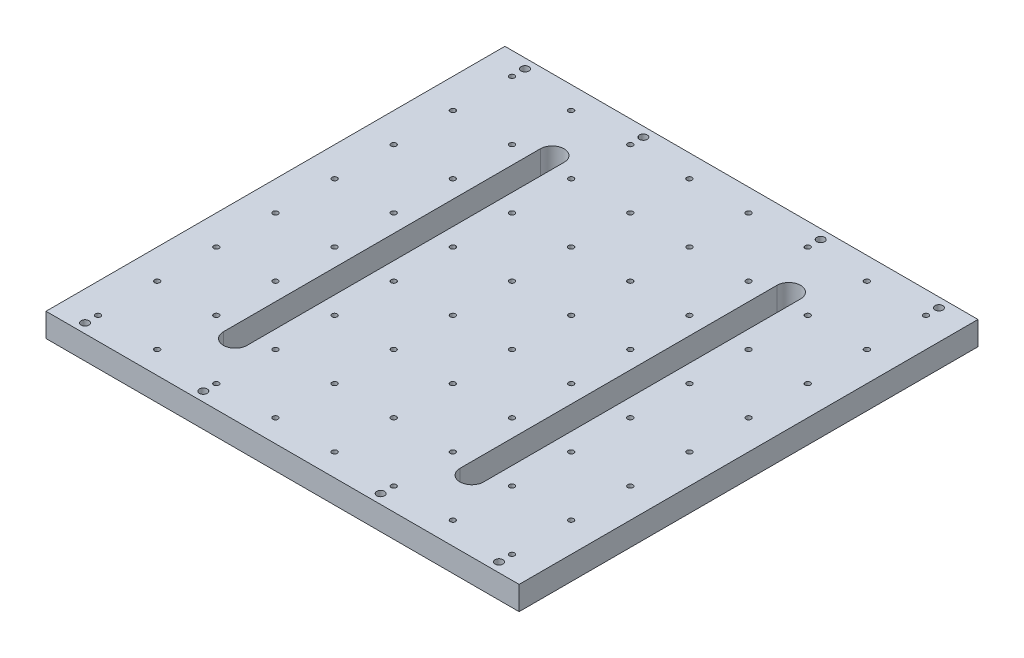
from build123d import *

# Parameters (mm, degrees)
SKETCH1_W           = 200
SKETCH1_H           = 194
BOSS_EXTRUDE2_DEPTH = 10
SKETCH2_R           = 1.1
CUT_EXTRUDE1_DEPTH  = 5
SKETCH5_R           = 1.65
CUT_EXTRUDE3_DEPTH  = 284.051232112
CUT_EXTRUDE4_DEPTH  = 10


with BuildPart() as part:
    # Sketch1 → Boss-Extrude2 (new body)
    with BuildSketch(Plane(origin=(0, 0, 0), x_dir=(1, 0, 0), z_dir=(0, 1, 0))):
        with Locations((103, 100)):
            Rectangle(SKETCH1_W, SKETCH1_H)
    extrude(amount=BOSS_EXTRUDE2_DEPTH)

    # Sketch2 → Cut-Extrude1 (cut)
    with BuildSketch(Plane(origin=(0, 10, 0), x_dir=(1, 0, 0), z_dir=(0, 1, 0))):
        with Locations(Location((115.5, 187.5, 0), (0, 0, 270))):
            Circle(SKETCH2_R)
        with Locations(Location((140.5, 187.5, 0), (0, 0, 270))):
            Circle(SKETCH2_R)
        with Locations(Location((165.5, 187.5, 0), (0, 0, 270))):
            Circle(SKETCH2_R)
        with Locations(Location((190.5, 187.5, 0), (0, 0, 270))):
            Circle(SKETCH2_R)
        with Locations(Location((115.5, 162.5, 0), (0, 0, 270))):
            Circle(SKETCH2_R)
        with Locations(Location((140.5, 162.5, 0), (0, 0, 270))):
            Circle(SKETCH2_R)
        with Locations(Location((165.5, 162.5, 0), (0, 0, 270))):
            Circle(SKETCH2_R)
        with Locations(Location((190.5, 162.5, 0), (0, 0, 270))):
            Circle(SKETCH2_R)
        with Locations(Location((115.5, 137.5, 0), (0, 0, 270))):
            Circle(SKETCH2_R)
        with Locations(Location((140.5, 137.5, 0), (0, 0, 270))):
            Circle(SKETCH2_R)
        with Locations(Location((165.5, 137.5, 0), (0, 0, 270))):
            Circle(SKETCH2_R)
        with Locations(Location((190.5, 137.5, 0), (0, 0, 270))):
            Circle(SKETCH2_R)
        with Locations(Location((115.5, 112.5, 0), (0, 0, 270))):
            Circle(SKETCH2_R)
        with Locations(Location((140.5, 112.5, 0), (0, 0, 270))):
            Circle(SKETCH2_R)
        with Locations(Location((165.5, 112.5, 0), (0, 0, 270))):
            Circle(SKETCH2_R)
        with Locations(Location((190.5, 112.5, 0), (0, 0, 270))):
            Circle(SKETCH2_R)
        with Locations(Location((65.5, 112.5, 0), (0, 0, 90))):
            Circle(SKETCH2_R)
        with Locations(Location((90.5, 112.5, 0), (0, 0, 90))):
            Circle(SKETCH2_R)
        with Locations(Location((40.5, 112.5, 0), (0, 0, 90))):
            Circle(SKETCH2_R)
        with Locations(Location((15.5, 112.5, 0), (0, 0, 90))):
            Circle(SKETCH2_R)
        with Locations(Location((15.5, 137.5, 0), (0, 0, 90))):
            Circle(SKETCH2_R)
        with Locations(Location((40.5, 137.5, 0), (0, 0, 90))):
            Circle(SKETCH2_R)
        with Locations(Location((65.5, 137.5, 0), (0, 0, 90))):
            Circle(SKETCH2_R)
        with Locations(Location((90.5, 137.5, 0), (0, 0, 90))):
            Circle(SKETCH2_R)
        with Locations(Location((65.5, 162.5, 0), (0, 0, 90))):
            Circle(SKETCH2_R)
        with Locations(Location((90.5, 162.5, 0), (0, 0, 90))):
            Circle(SKETCH2_R)
        with Locations(Location((40.5, 162.5, 0), (0, 0, 90))):
            Circle(SKETCH2_R)
        with Locations(Location((15.5, 162.5, 0), (0, 0, 90))):
            Circle(SKETCH2_R)
        with Locations(Location((15.5, 187.5, 0), (0, 0, 90))):
            Circle(SKETCH2_R)
        with Locations(Location((40.5, 187.5, 0), (0, 0, 90))):
            Circle(SKETCH2_R)
        with Locations(Location((65.5, 187.5, 0), (0, 0, 90))):
            Circle(SKETCH2_R)
        with Locations(Location((90.5, 187.5, 0), (0, 0, 90))):
            Circle(SKETCH2_R)
        with Locations(Location((190.5, 87.5, 0), (0, 0, 90))):
            Circle(SKETCH2_R)
        with Locations(Location((165.5, 87.5, 0), (0, 0, 90))):
            Circle(SKETCH2_R)
        with Locations(Location((140.5, 87.5, 0), (0, 0, 90))):
            Circle(SKETCH2_R)
        with Locations(Location((115.5, 87.5, 0), (0, 0, 90))):
            Circle(SKETCH2_R)
        with Locations(Location((190.5, 62.5, 0), (0, 0, 90))):
            Circle(SKETCH2_R)
        with Locations(Location((165.5, 62.5, 0), (0, 0, 90))):
            Circle(SKETCH2_R)
        with Locations(Location((140.5, 62.5, 0), (0, 0, 90))):
            Circle(SKETCH2_R)
        with Locations(Location((115.5, 62.5, 0), (0, 0, 90))):
            Circle(SKETCH2_R)
        with Locations(Location((190.5, 37.5, 0), (0, 0, 90))):
            Circle(SKETCH2_R)
        with Locations(Location((165.5, 37.5, 0), (0, 0, 90))):
            Circle(SKETCH2_R)
        with Locations(Location((140.5, 37.5, 0), (0, 0, 90))):
            Circle(SKETCH2_R)
        with Locations(Location((115.5, 37.5, 0), (0, 0, 90))):
            Circle(SKETCH2_R)
        with Locations(Location((190.5, 12.5, 0), (0, 0, 90))):
            Circle(SKETCH2_R)
        with Locations(Location((165.5, 12.5, 0), (0, 0, 90))):
            Circle(SKETCH2_R)
        with Locations(Location((140.5, 12.5, 0), (0, 0, 90))):
            Circle(SKETCH2_R)
        with Locations(Location((115.5, 12.5, 0), (0, 0, 90))):
            Circle(SKETCH2_R)
        with Locations(Location((90.5, 12.5, 0), (0, 0, 270))):
            Circle(SKETCH2_R)
        with Locations(Location((65.5, 12.5, 0), (0, 0, 270))):
            Circle(SKETCH2_R)
        with Locations(Location((40.5, 12.5, 0), (0, 0, 270))):
            Circle(SKETCH2_R)
        with Locations(Location((15.5, 12.5, 0), (0, 0, 270))):
            Circle(SKETCH2_R)
        with Locations(Location((90.5, 37.5, 0), (0, 0, 270))):
            Circle(SKETCH2_R)
        with Locations(Location((65.5, 37.5, 0), (0, 0, 270))):
            Circle(SKETCH2_R)
        with Locations(Location((40.5, 37.5, 0), (0, 0, 270))):
            Circle(SKETCH2_R)
        with Locations(Location((15.5, 37.5, 0), (0, 0, 270))):
            Circle(SKETCH2_R)
        with Locations(Location((90.5, 62.5, 0), (0, 0, 270))):
            Circle(SKETCH2_R)
        with Locations(Location((65.5, 62.5, 0), (0, 0, 270))):
            Circle(SKETCH2_R)
        with Locations(Location((40.5, 62.5, 0), (0, 0, 270))):
            Circle(SKETCH2_R)
        with Locations(Location((15.5, 62.5, 0), (0, 0, 270))):
            Circle(SKETCH2_R)
        with Locations(Location((90.5, 87.5, 0), (0, 0, 270))):
            Circle(SKETCH2_R)
        with Locations(Location((65.5, 87.5, 0), (0, 0, 270))):
            Circle(SKETCH2_R)
        with Locations(Location((40.5, 87.5, 0), (0, 0, 270))):
            Circle(SKETCH2_R)
        with Locations(Location((15.5, 87.5, 0), (0, 0, 270))):
            Circle(SKETCH2_R)
    extrude(amount=-CUT_EXTRUDE1_DEPTH, mode=Mode.SUBTRACT)

    # Sketch5 → Cut-Extrude3 (cut, through all)
    with BuildSketch(Plane(origin=(0, 10, 0), x_dir=(1, 0, 0), z_dir=(0, 1, 0))):
        with Locations(Location((15.5, 193, 0), (0, 0, 270))):
            Circle(SKETCH5_R)
        with Locations(Location((65.5, 193, 0), (0, 0, 270))):
            Circle(SKETCH5_R)
        with Locations(Location((140.5, 193, 0), (0, 0, 270))):
            Circle(SKETCH5_R)
        with Locations(Location((190.5, 193, 0), (0, 0, 270))):
            Circle(SKETCH5_R)
        with Locations(Location((190.5, 7, 0), (0, 0, 90))):
            Circle(SKETCH5_R)
        with Locations(Location((140.5, 7, 0), (0, 0, 90))):
            Circle(SKETCH5_R)
        with Locations(Location((65.5, 7, 0), (0, 0, 90))):
            Circle(SKETCH5_R)
        with Locations(Location((15.5, 7, 0), (0, 0, 90))):
            Circle(SKETCH5_R)
    extrude(amount=-CUT_EXTRUDE3_DEPTH, mode=Mode.SUBTRACT)

    # Sketch6 → Cut-Extrude4 (cut)
    with BuildSketch(Plane(origin=(0, 10, 0), x_dir=(1, 0, 0), z_dir=(0, 1, 0))):
        with BuildLine():
            Line((48, 33), (48, 167))
            ThreePointArc((48, 167), (53, 172), (58, 167))
            Line((58, 167), (58, 33))
            ThreePointArc((58, 33), (53, 28), (48, 33))
        make_face()
        with BuildLine():
            Line((158, 33), (158, 167))
            ThreePointArc((158, 167), (153, 172), (148, 167))
            Line((148, 167), (148, 33))
            ThreePointArc((148, 33), (153, 28), (158, 33))
        make_face()
    extrude(amount=-CUT_EXTRUDE4_DEPTH, mode=Mode.SUBTRACT)


solid = part.part
